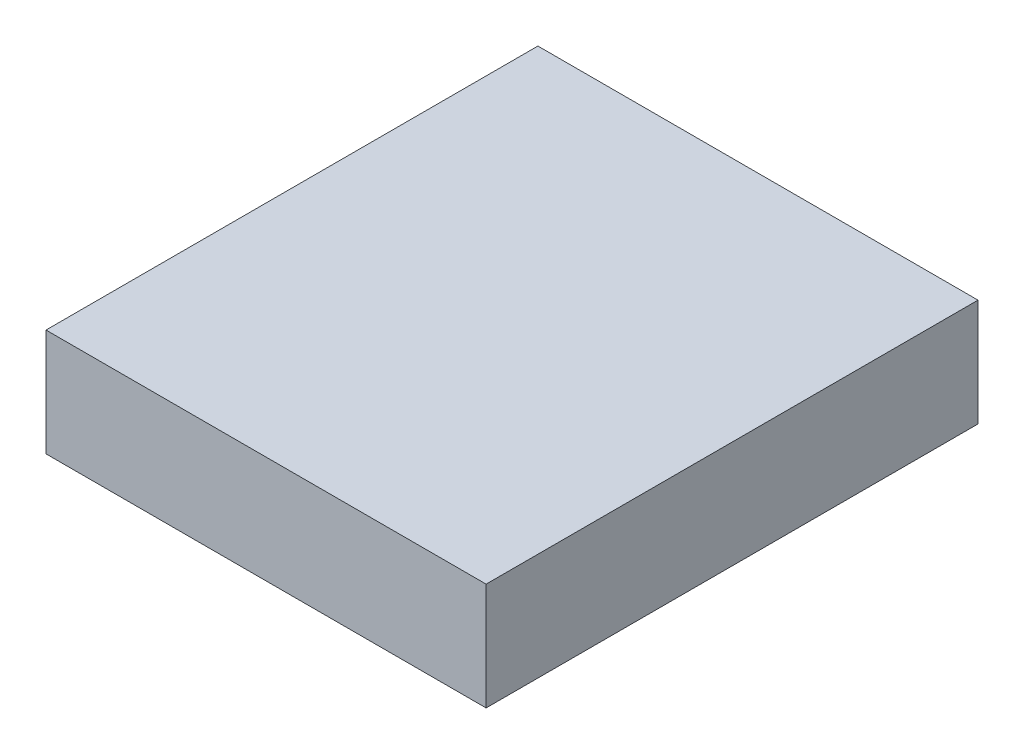
from build123d import *

# Parameters (mm, degrees)
SKETCH1_W           = 29.75
SKETCH1_H           = 33.25
BOSS_EXTRUDE1_DEPTH = 7.25


with BuildPart() as part:
    # Sketch1 → Boss-Extrude1 (new body)
    with BuildSketch(Plane(origin=(0, 0, 0), x_dir=(1, 0, 0), z_dir=(0, 1, 0))):
        with Locations((14.875, 16.625)):
            Rectangle(SKETCH1_W, SKETCH1_H)
    extrude(amount=BOSS_EXTRUDE1_DEPTH)


solid = part.part
